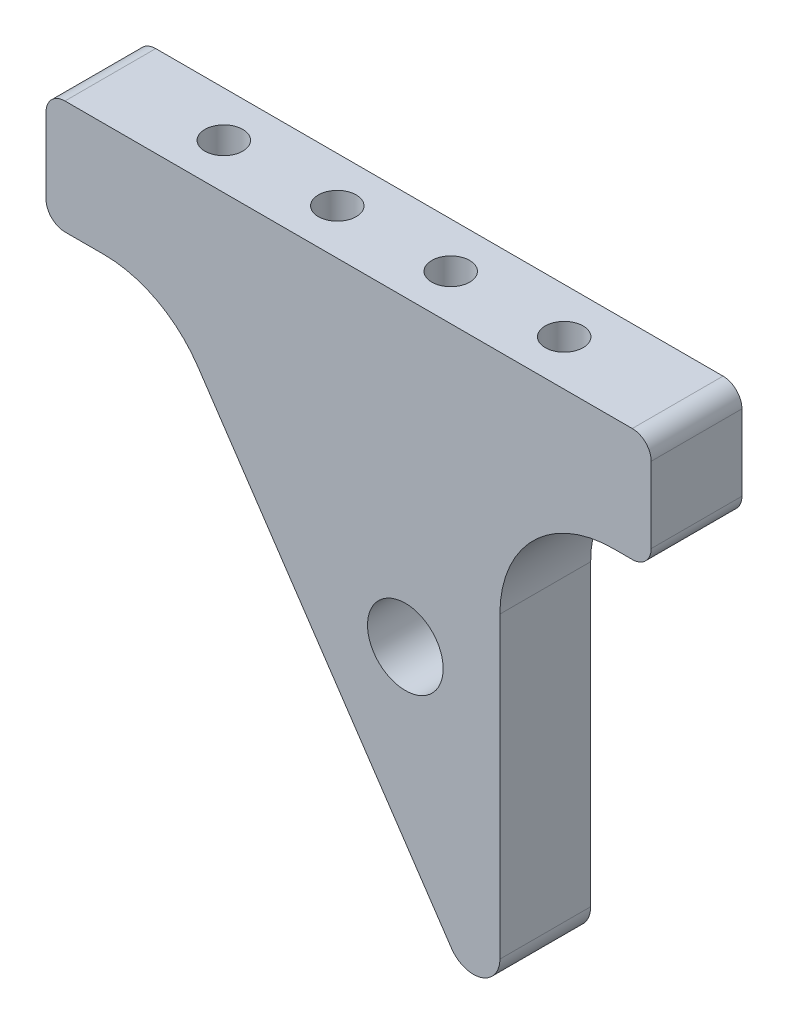
from build123d import *

# Parameters (mm, degrees)
SKETCH_1_R          = 5
EXTRUDE_1_DEPTH     = 12
SKETCH_2_R          = 2.5
CUT_EXTRUDE_1_DEPTH = 10


with BuildPart() as part:
    # 草图1 → 凸台-拉伸1 (new body)
    with BuildSketch(Plane.XY):
        with BuildLine():
            Line((12.5, 0), (12.5, -29.5))
            ThreePointArc((12.5, -29.5), (10.021323251, -32.847670655), (6.096057819, -31.453745072))
            Line((6.096057819, -31.453745072), (-10.371222076, -6.977660972))
            Line((-10.371222076, -6.977660972), (-27.427039052, 18.373193167))
            ThreePointArc((-27.427039052, 18.373193167), (-32.822608292, 23.240050935), (-39.872505543, 25))
            Line((-39.872505543, 25), (-45, 25))
            ThreePointArc((-45, 25), (-46.767766953, 25.732233047), (-47.5, 27.5))
            Line((-47.5, 27.5), (-47.5, 37.5))
            ThreePointArc((-47.5, 37.5), (-46.767766953, 39.267766953), (-45, 40))
            Line((-45, 40), (30, 40))
            ThreePointArc((30, 40), (31.767766953, 39.267766953), (32.5, 37.5))
            Line((32.5, 37.5), (32.5, 27.5))
            ThreePointArc((32.5, 27.5), (31.767766953, 25.732233047), (30, 25))
            Line((30, 25), (27.5, 25))
            ThreePointArc((27.5, 25), (16.893398282, 20.606601718), (12.5, 10))
            Line((12.5, 10), (12.5, 0))
        make_face()
        Circle(SKETCH_1_R, mode=Mode.SUBTRACT)
    extrude(amount=EXTRUDE_1_DEPTH)

    # 草图2 → 切除-拉伸1 (cut)
    with BuildSketch(Plane(origin=(0, 40, 0), x_dir=(1, 0, 0), z_dir=(0, 1, 0))):
        with Locations(Location((-30, -6, 0), (0, 0, 270))):
            Circle(SKETCH_2_R)
        with Locations(Location((-15, -6, 0), (0, 0, 270))):
            Circle(SKETCH_2_R)
        with Locations(Location((0, -6, 0), (0, 0, 270))):
            Circle(SKETCH_2_R)
        with Locations(Location((15, -6, 0), (0, 0, 270))):
            Circle(SKETCH_2_R)
    extrude(amount=-CUT_EXTRUDE_1_DEPTH, mode=Mode.SUBTRACT)


solid = part.part
